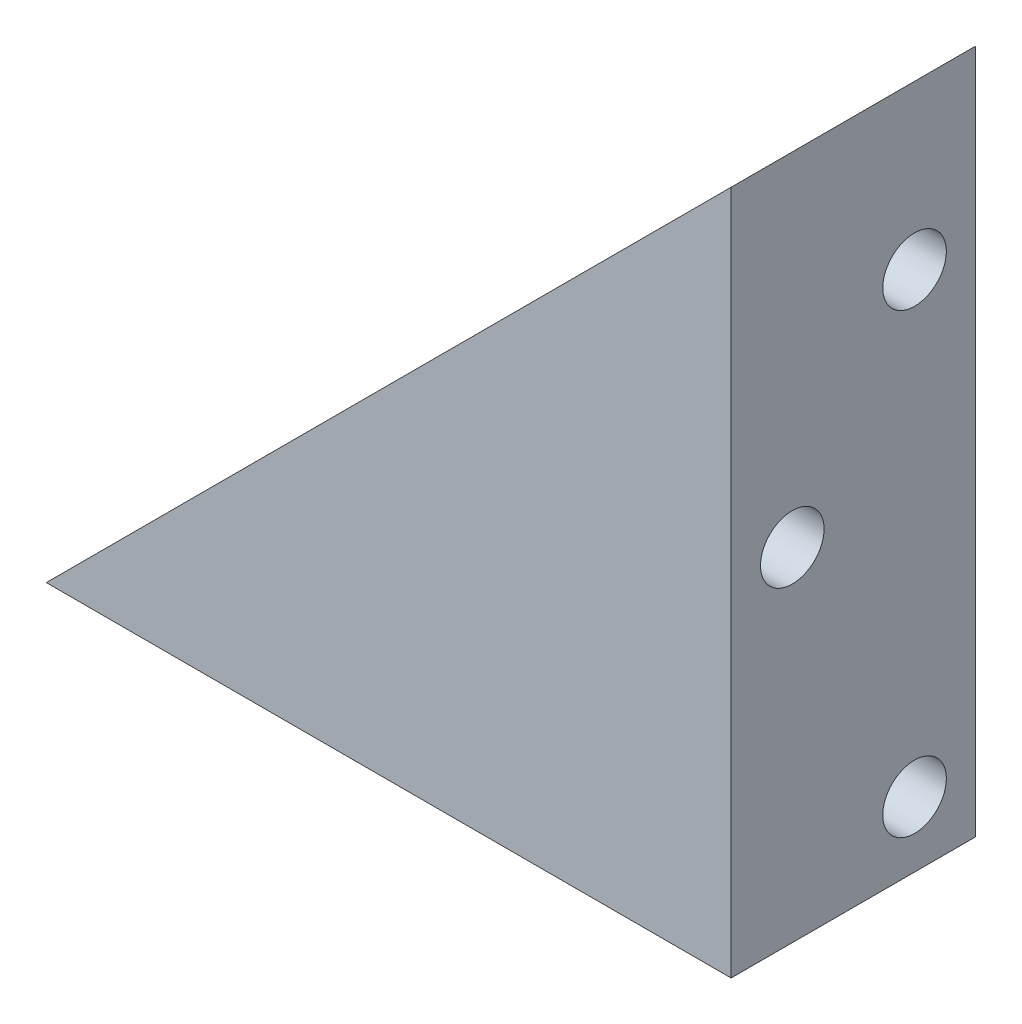
from build123d import *

# Parameters (mm, degrees)
BOSS_EXTRUDE1_DEPTH = 15
SKETCH3_R           = 2
CUT_EXTRUDE1_DEPTH  = 20
SKETCH4_R           = 1.95
CUT_EXTRUDE2_DEPTH  = 5.4


with BuildPart() as part:
    # Sketch1 → Boss-Extrude1 (new body)
    with BuildSketch(Plane.XY):
        Polygon((0, 0), (42, 0), (42, 42), align=None)
    extrude(amount=BOSS_EXTRUDE1_DEPTH)

    # Sketch3 → Cut-Extrude1 (cut)
    with BuildSketch(Plane(origin=(0, 0, 0), x_dir=(0, 0, 1), z_dir=(-0.7071067811865477, 0.7071067811865475, 0))):
        with Locations(Location((7.5, 29.69848481, 0), (0, 0, 270))):
            Circle(SKETCH3_R)
    extrude(amount=-CUT_EXTRUDE1_DEPTH, mode=Mode.SUBTRACT)

    # Sketch4 → Cut-Extrude2 (cut)
    with BuildSketch(Plane(origin=(42, 0, 0), x_dir=(0, 0, -1), z_dir=(1, 0, 0))):
        with Locations((-11.25, 21)):
            Circle(SKETCH4_R)
        with Locations((-3.75, 4)):
            Circle(SKETCH4_R)
        with Locations((-3.75, 32)):
            Circle(SKETCH4_R)
    extrude(amount=-CUT_EXTRUDE2_DEPTH, mode=Mode.SUBTRACT)


solid = part.part
